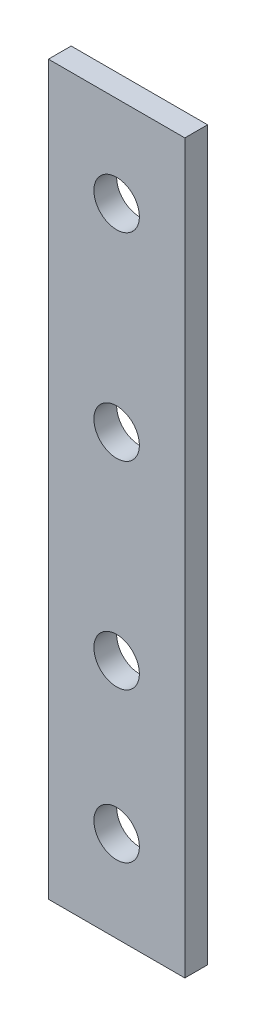
from build123d import *

# Parameters (mm, degrees)
SKETCH1_W           = 19.05
SKETCH1_H           = 101.6
SKETCH1_R           = 3.175
BOSS_EXTRUDE1_DEPTH = 3.175


with BuildPart() as part:
    # Sketch1 → Boss-Extrude1 (new body)
    with BuildSketch(Plane.XY):
        with Locations((9.525, 50.8)):
            Rectangle(SKETCH1_W, SKETCH1_H)
        with Locations((9.525, 88.9)):
            Circle(SKETCH1_R, mode=Mode.SUBTRACT)
        with Locations((9.525, 33.6169)):
            Circle(SKETCH1_R, mode=Mode.SUBTRACT)
        with Locations((9.525, 61.25845)):
            Circle(SKETCH1_R, mode=Mode.SUBTRACT)
        with Locations((9.525, 12.7)):
            Circle(SKETCH1_R, mode=Mode.SUBTRACT)
    extrude(amount=BOSS_EXTRUDE1_DEPTH)


solid = part.part
